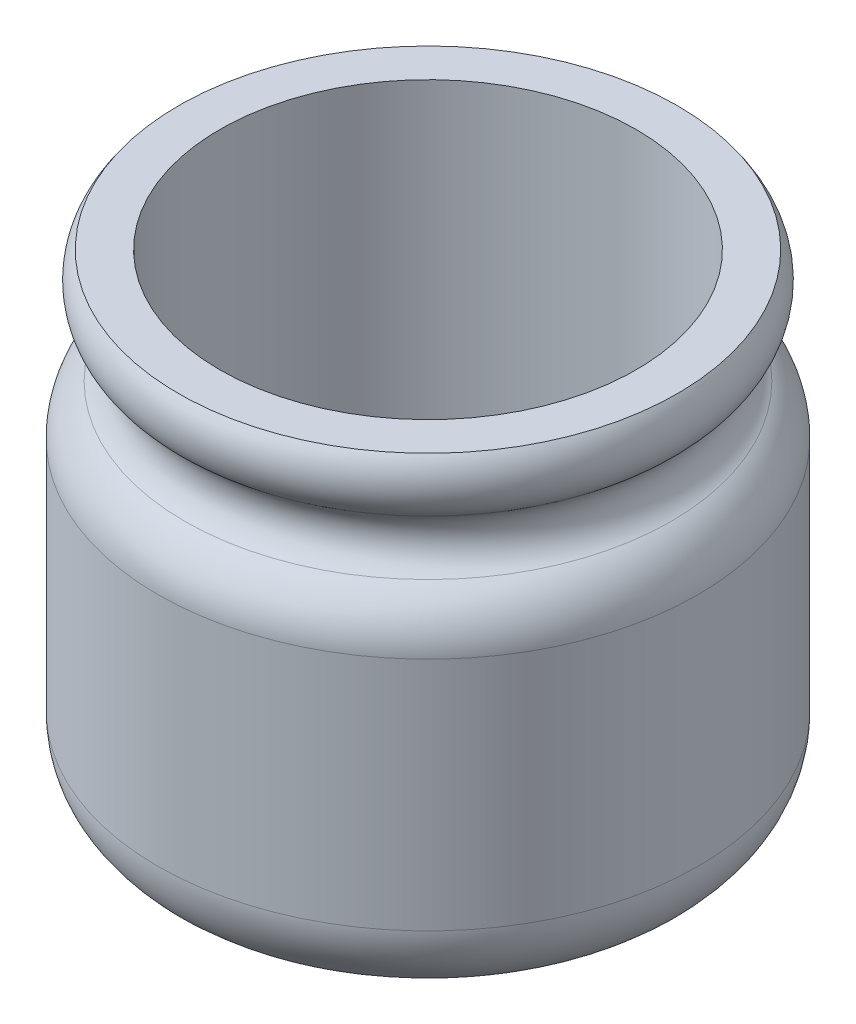
from build123d import *


with BuildPart() as part:
    # 스케치2 → 회전1 (revolve)
    with BuildSketch(Plane(origin=(0, 0, 0), x_dir=(0, 0, -1), z_dir=(1, 0, 0))):
        with BuildLine():
            Line((10.1, 0), (12.1, 0))
            ThreePointArc((12.1, 0), (12.521081242, -1.48943877), (11.796548935, -2.857207098))
            ThreePointArc((11.796548935, -2.857207098), (11.081359136, -4.188050052), (11.796542721, -5.518896345))
            ThreePointArc((11.796542721, -5.518896345), (12.753495116, -6.567634704), (13.1, -7.944422413))
            Line((13.1, -7.944422413), (13.1, -19.359260843))
            ThreePointArc((13.1, -19.359260843), (11.975073546, -22.075073546), (9.259260843, -23.2))
            Line((9.259260843, -23.2), (0, -23.2))
            Line((0, -23.2), (0, -20.2))
            Line((0, -20.2), (10.1, -20.2))
            Line((10.1, -20.2), (10.1, 0))
        make_face()
    revolve(axis=Axis((0, -20.2, 0), (0, 1, 0)))


solid = part.part
